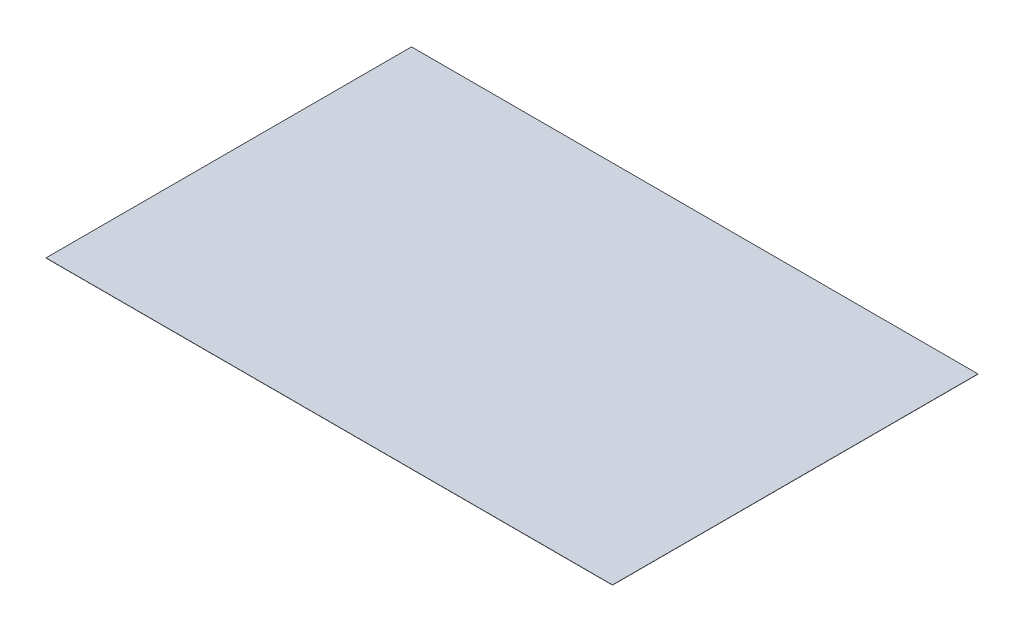
from build123d import *

# Parameters (mm, degrees)
SKETCH_1_W      = 3100
SKETCH_1_H      = 2000
EXTRUDE_1_DEPTH = 1


with BuildPart() as part:
    # Эскиз1 → Бобышка-Вытянуть1 (new body)
    with BuildSketch(Plane(origin=(0, 0, 0), x_dir=(1, 0, 0), z_dir=(0, 1, 0))):
        Rectangle(SKETCH_1_W, SKETCH_1_H)
    extrude(amount=EXTRUDE_1_DEPTH)


solid = part.part
